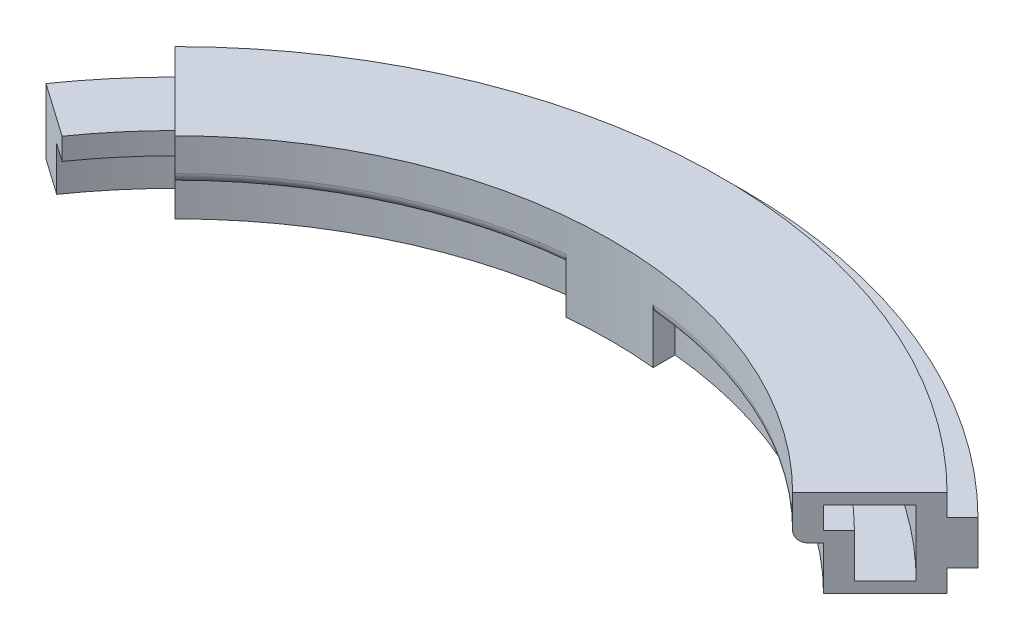
from build123d import *

# Parameters (mm, degrees)
BOSS_EXTRUDE1_DEPTH = 10
BOSS_EXTRUDE2_DEPTH = 10
SKETCH3_W           = 10
SKETCH3_H           = 10
REVOLVE1_ANGLE      = 10
SKETCH4_W           = 10
SKETCH4_H           = 10
CUT_REVOLVE1_ANGLE  = 12
SKETCH5_W           = 10
SKETCH5_H           = 10
REVOLVE2_ANGLE      = 90
FILLET1_R           = 2.5


with BuildPart() as part:
    # Sketch1 → Boss-Extrude1 (new body)
    with BuildSketch(Plane(origin=(0, 0, 0), x_dir=(1, 0, 0), z_dir=(0, 1, 0))):
        with BuildLine():
            ThreePointArc((10, 104.522724802), (44.760729067, 94.981456787), (74.246212025, 74.246212025))
            Line((74.246212025, 74.246212025), (88.388347648, 88.388347648))
            ThreePointArc((88.388347648, 88.388347648), (0, 125), (-88.388347648, 88.388347648))
            Line((-88.388347648, 88.388347648), (-74.246212025, 74.246212025))
            ThreePointArc((-74.246212025, 74.246212025), (-44.760729067, 94.981456787), (-10, 104.522724802))
            Line((-10, 104.522724802), (-10, 105))
            Line((-10, 105), (7e-08, 105))
            Line((7e-08, 105), (10, 105))
            Line((10, 105), (10, 104.522724802))
        make_face()
        with BuildLine():
            ThreePointArc((-10, 99.498743711), (0, 100), (10, 99.498743711))
            Line((10, 99.498743711), (10, 104.522724802))
            ThreePointArc((10, 104.522724802), (5.005691586, 104.880613327), (7e-08, 105))
            ThreePointArc((7e-08, 105), (-5.005691516, 104.88061333), (-10, 104.522724802))
            Line((-10, 104.522724802), (-10, 99.498743711))
        make_face()
        with BuildLine():
            ThreePointArc((7e-08, 105), (5.005691586, 104.880613327), (10, 104.522724802))
            Line((10, 104.522724802), (10, 105))
            Line((10, 105), (7e-08, 105))
        make_face()
        with BuildLine():
            Line((-10, 105), (-10, 104.522724802))
            ThreePointArc((-10, 104.522724802), (-5.005691516, 104.88061333), (7e-08, 105))
            Line((7e-08, 105), (-10, 105))
        make_face()
    extrude(amount=BOSS_EXTRUDE1_DEPTH)

    # Sketch2 → Boss-Extrude2 (add)
    with BuildSketch(Plane(origin=(0, 10, 0), x_dir=(1, 0, 0), z_dir=(0, 1, 0))):
        with BuildLine():
            Line((-88.388347648, 88.388347648), (-74.246212025, 74.246212025))
            ThreePointArc((-74.246212025, 74.246212025), (-44.760729067, 94.981456787), (-10, 104.522724802))
            Line((-10, 104.522724802), (-10, 99.498743711))
            ThreePointArc((-10, 99.498743711), (0, 100), (10, 99.498743711))
            Line((10, 99.498743711), (10, 104.522724802))
            ThreePointArc((10, 104.522724802), (44.760729067, 94.981456787), (74.246212025, 74.246212025))
            Line((74.246212025, 74.246212025), (88.388347648, 88.388347648))
            ThreePointArc((88.388347648, 88.388347648), (0, 125), (-88.388347648, 88.388347648))
        make_face()
        with BuildLine():
            ThreePointArc((-10, 104.522724802), (-44.760729067, 94.981456787), (-74.246212025, 74.246212025))
            Line((-74.246212025, 74.246212025), (-70.710678119, 70.710678119))
            ThreePointArc((-70.710678119, 70.710678119), (-42.845554854, 90.356286053), (-10, 99.498743711))
            Line((-10, 99.498743711), (-10, 104.522724802))
        make_face()
        with BuildLine():
            Line((70.710678119, 70.710678119), (74.246212025, 74.246212025))
            ThreePointArc((74.246212025, 74.246212025), (44.760729067, 94.981456787), (10, 104.522724802))
            Line((10, 104.522724802), (10, 99.498743711))
            ThreePointArc((10, 99.498743711), (42.845554854, 90.356286053), (70.710678119, 70.710678119))
        make_face()
    extrude(amount=BOSS_EXTRUDE2_DEPTH)

    # Sketch3 → Revolve1 (revolve)
    with BuildSketch(Plane(origin=(0, 0, 0), x_dir=(0.7071067811865512, 0, 0.7071067811865438), z_dir=(-0.7071067811865438, 0, 0.7071067811865512))):
        Polygon((-120, 17.5), (-120, 12.5), (-110, 12.5), (-105, 12.5), (-105, 17.5), align=None)
        with Locations((-115, 7.5)):
            Rectangle(SKETCH3_W, SKETCH3_H)
    revolve(axis=Axis((0, 0, 0), (0, 1, 0)), revolution_arc=REVOLVE1_ANGLE)

    # Sketch4 → Cut-Revolve1 (revolve, cut)
    with BuildSketch(Plane(origin=(0, 0, 0), x_dir=(0.7071067811865507, 0, -0.7071067811865445), z_dir=(0.7071067811865445, 0, 0.7071067811865507))):
        Polygon((105, 12.5), (110, 12.5), (120, 12.5), (120, 17.5), (105, 17.5), align=None)
        with Locations((115, 7.5)):
            Rectangle(SKETCH4_W, SKETCH4_H)
    revolve(axis=Axis((0, 0, 0), (0, 1, 0)), revolution_arc=CUT_REVOLVE1_ANGLE, mode=Mode.SUBTRACT)

    # Sketch5 → Revolve2 (revolve)
    with BuildSketch(Plane(origin=(0, 0, 0), x_dir=(0.7071067811865512, 0, 0.7071067811865438), z_dir=(-0.7071067811865438, 0, 0.7071067811865512))):
        with Locations((-125, 10)):
            Rectangle(SKETCH5_W, SKETCH5_H)
    revolve(axis=Axis((0, 0, 0), (0, -1, 0)), revolution_arc=REVOLVE2_ANGLE)

    # Fillet1
    fillet1_edges = [part.edges().sort_by_distance(p)[0] for p in [
        (-42.845554854, 10, -90.356286053),
        (42.845554854, 10, -90.356286053),
    ]]
    fillet(fillet1_edges, radius=FILLET1_R)


solid = part.part
